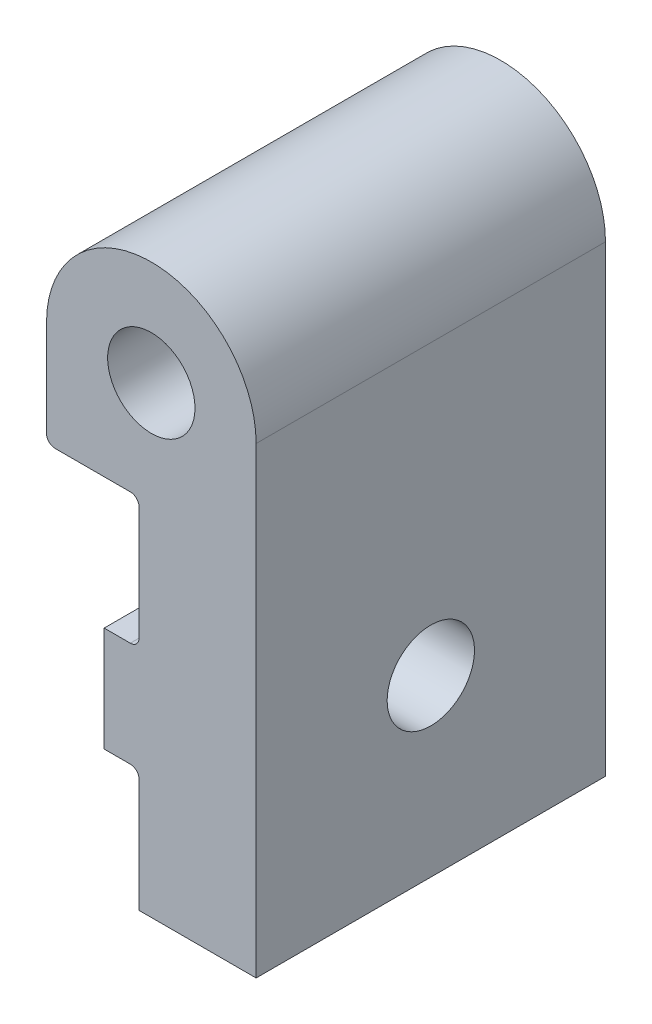
from build123d import *

# Parameters (mm, degrees)
SKETCH1_R           = 2.5
BOSS_EXTRUDE1_DEPTH = 20
SKETCH2_R           = 2.5
CUT_EXTRUDE1_DEPTH  = 20
SKETCH3_W           = 10
SKETCH3_H           = 6
CUT_EXTRUDE2_DEPTH  = 2
FILLET1_R           = 0.5
FILLET2_R           = 0.5


with BuildPart() as part:
    # Sketch1 → Boss-Extrude1 (new body)
    with BuildSketch(Plane.XY):
        with BuildLine():
            Line((6.3, -53.6), (6.3, -59.6))
            Line((6.3, -59.6), (7.3, -59.6))
            Line((7.3, -59.6), (8.3, -59.6))
            Line((8.3, -59.6), (8.3, -60.1))
            Line((8.3, -60.1), (8.3, -66.6))
            Line((8.3, -66.6), (15, -66.6))
            Line((15, -66.6), (15, -40.1))
            ThreePointArc((15, -40.1), (9, -34.1), (3, -40.1))
            Line((3, -40.1), (3, -46.1))
            Line((3, -46.1), (8.3, -46.1))
            Line((8.3, -46.1), (8.3, -46.6))
            Line((8.3, -46.6), (8.3, -53.1))
            Line((8.3, -53.1), (8.3, -53.6))
            Line((8.3, -53.6), (7.3, -53.6))
            Line((7.3, -53.6), (6.3, -53.6))
        make_face()
        with Locations((9, -40.1)):
            Circle(SKETCH1_R, mode=Mode.SUBTRACT)
    extrude(amount=BOSS_EXTRUDE1_DEPTH)

    # Sketch2 → Cut-Extrude1 (cut)
    with BuildSketch(Plane.ZY.offset(-6.3)):
        with Locations((10, -56.6)):
            Circle(SKETCH2_R)
    extrude(amount=-CUT_EXTRUDE1_DEPTH, mode=Mode.SUBTRACT)

    # Sketch3 → Cut-Extrude2 (cut)
    with BuildSketch(Plane.ZY.offset(-6.3)):
        with Locations((10, -56.6)):
            Rectangle(SKETCH3_W, SKETCH3_H)
    extrude(amount=-CUT_EXTRUDE2_DEPTH, mode=Mode.SUBTRACT)

    # Fillet1
    fillet1_edges = [part.edges().sort_by_distance(p)[0] for p in [
        (8.3, -46.1, 10),
        (3, -46.1, 10),
    ]]
    fillet(fillet1_edges, radius=FILLET1_R)

    # Fillet2
    fillet2_edges = [part.edges().sort_by_distance(p)[0] for p in [
        (8.3, -59.6, 17.5),
        (8.3, -53.6, 17.5),
        (8.3, -53.6, 2.5),
        (8.3, -59.6, 2.5),
    ]]
    fillet(fillet2_edges, radius=FILLET2_R)


solid = part.part
